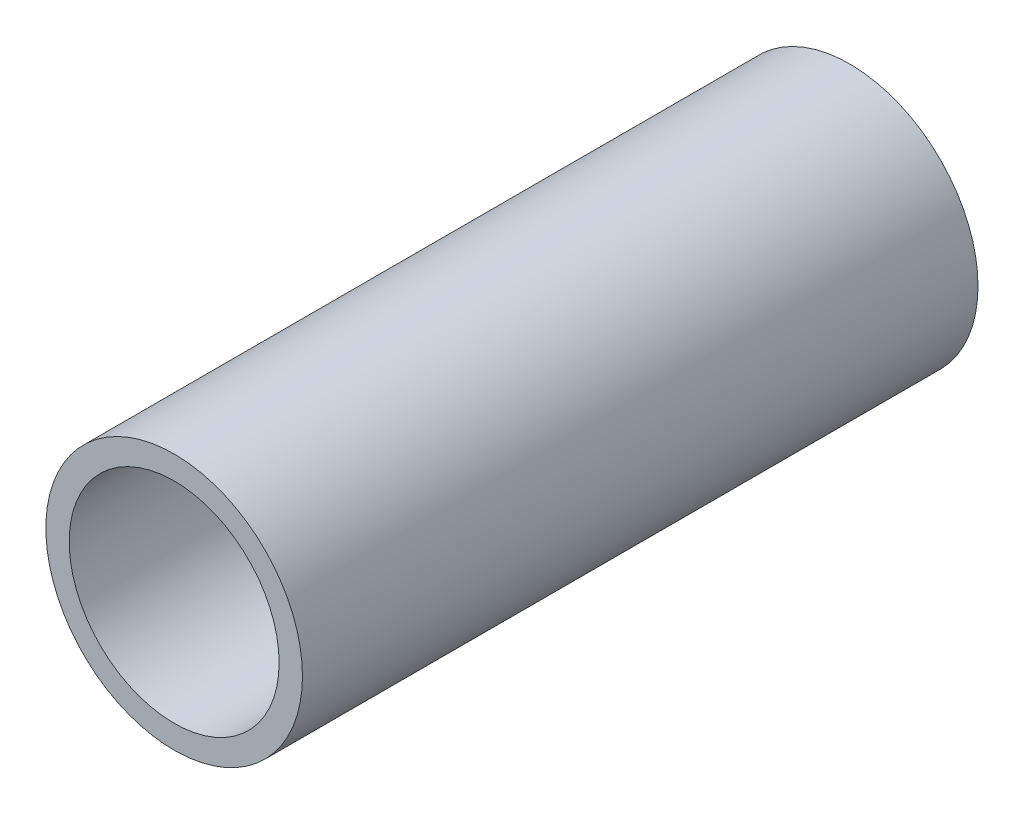
from build123d import *

# Parameters (mm, degrees)
SKETCH2_R           = 8.73125
SKETCH2_R_2         = 7.14375
BOSS_EXTRUDE1_DEPTH = 45.974


with BuildPart() as part:
    # Sketch2 → Boss-Extrude1 (new body)
    with BuildSketch(Plane.XY):
        Circle(SKETCH2_R)
        Circle(SKETCH2_R_2, mode=Mode.SUBTRACT)
    extrude(amount=-BOSS_EXTRUDE1_DEPTH)


solid = part.part
